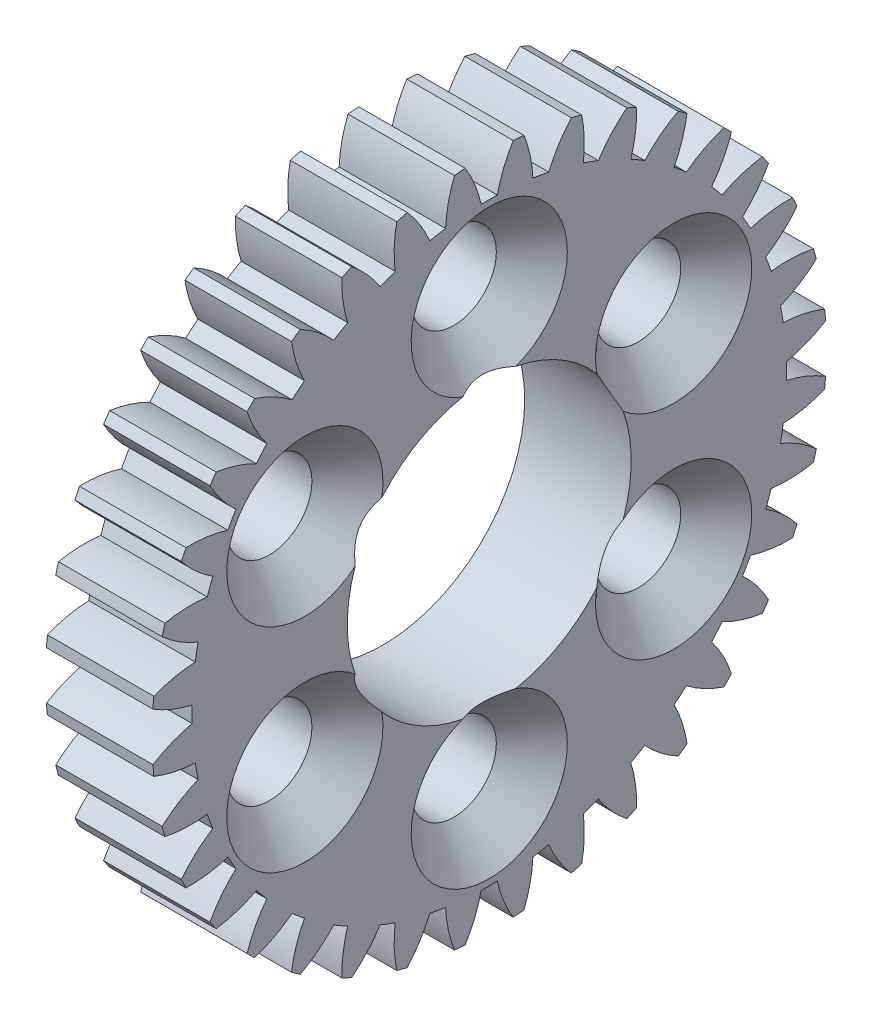
from build123d import *

# Parameters (mm, degrees)
BASPROSKE_W           = 3
BASPROSKE_H           = 9.5
TOOTHCUT_DEPTH        = 14.765899898
TEETHCUTS_COUNT       = 36
TEETHCUTS_ANGLE       = 350
BORSKE_R              = 4
BORE_DEPTH            = 50.0000508
PADR_OCIRCULAR1_COUNT = 6


with BuildPart() as part:
    # BasProSke → Base-Revolve (revolve)
    with BuildSketch(Plane(origin=(0, 0, 0), x_dir=(1, 0, 0), z_dir=(0, 1, 0)), mode=Mode.PRIVATE) as base_revolve_sk:
        with Locations((1.5, 4.75)):
            Rectangle(BASPROSKE_W, BASPROSKE_H)
    revolve(base_revolve_sk.sketch.rotate(Axis((-10, 0, 0), (1, 0, 0)), 180), axis=Axis((-10, 0, 0), (1, 0, 0)))

    # TooCutSke → ToothCut (cut, through all)
    with BuildSketch(Plane(origin=(0, 0, 0), x_dir=(0, 0, -1), z_dir=(1, 0, 0))):
        with BuildLine():
            ThreePointArc((0.227221176, 8.370916708), (0, 8.374), (-0.227221176, 8.370916708))
            ThreePointArc((-0.227221176, 8.370916708), (-0.411410437, 8.955426484), (-0.69207336, 9.500225241))
            ThreePointArc((-0.69207336, 9.500225241), (0, 9.5254), (0.69207336, 9.500225241))
            ThreePointArc((0.69207336, 9.500225241), (0.411410437, 8.955426484), (0.227221176, 8.370916708))
        make_face()
    toothcut = extrude(amount=TOOTHCUT_DEPTH, mode=Mode.SUBTRACT)

    # TeethCuts: ToothCut ×36 about axis
    teethcuts_axis = Axis((-10, 0, 0), (1, 0, 0))
    for i in range(1, TEETHCUTS_COUNT):
        add(toothcut.rotate(teethcuts_axis, i * TEETHCUTS_ANGLE / (TEETHCUTS_COUNT - 1)), mode=Mode.SUBTRACT)

    # BorSke → Bore (cut, symmetric)
    with BuildSketch(Plane(origin=(0, 0, 0), x_dir=(0, 0, -1), z_dir=(1, 0, 0))):
        with Locations(Location((0, 0, 0), (0, 0, 180))):
            Circle(BORSKE_R)
    extrude(amount=BORE_DEPTH, both=True, mode=Mode.SUBTRACT)

    # Esboço2 → Escareado para parafuso com cabeça escareada chata de M21 (revolve, cut)
    with BuildSketch(Plane(origin=(3, 6, 0), x_dir=(0, 0, -1), z_dir=(0, 1, 0))):
        Polygon((0, 0), (0, 3.721032743), (1.2, 3), (1.2, 1), (2.2, 0), align=None)
    escareado_para_parafuso_com_cabe_a_escar = revolve(axis=Axis((9.35, 6, 0), (-1, 0, 0)), mode=Mode.SUBTRACT)

    # PadrãoCircular1: Escareado para parafuso com cabeça escareada chata de M21 ×6 about axis
    padr_ocircular1_axis = Axis((0, 0, 0), (1, 0, 0))
    for i in range(1, PADR_OCIRCULAR1_COUNT):
        add(escareado_para_parafuso_com_cabe_a_escar.rotate(padr_ocircular1_axis, i * 360 / PADR_OCIRCULAR1_COUNT), mode=Mode.SUBTRACT)


solid = part.part
